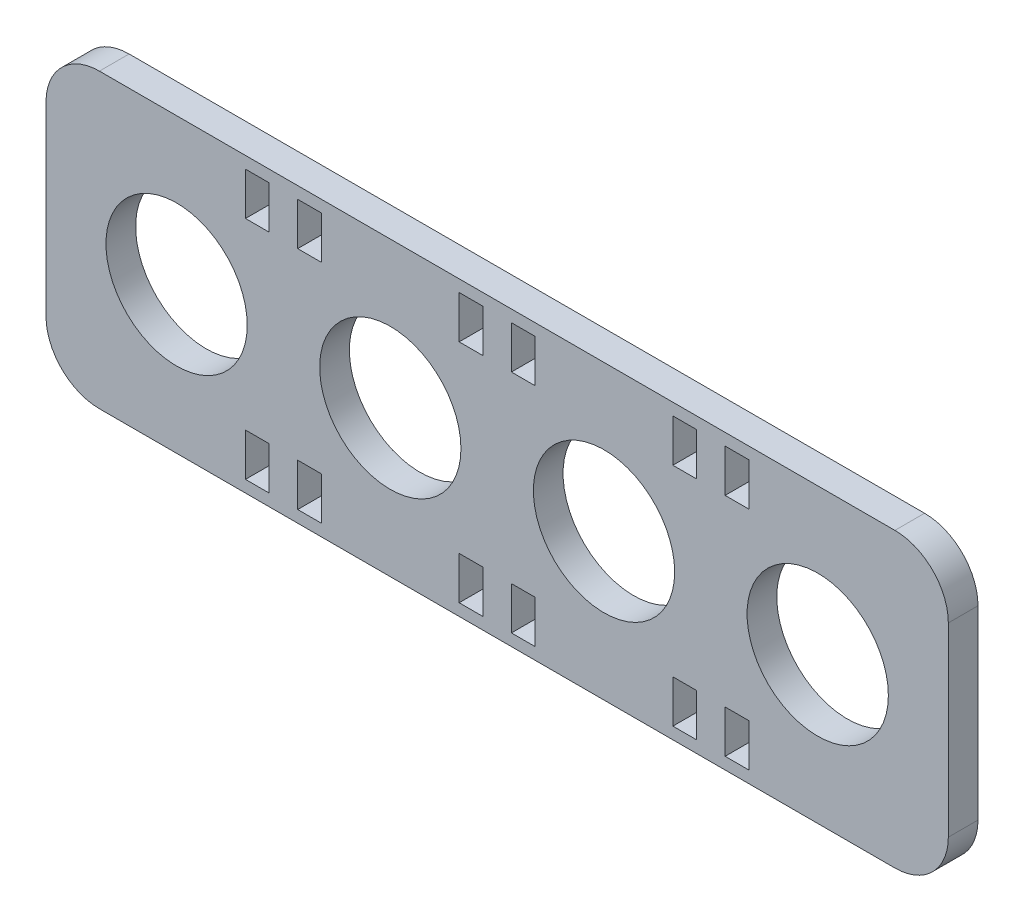
from build123d import *

# Parameters (mm, degrees)
SKETCH1_R           = 7.5565
SKETCH1_W           = 2.54
SKETCH1_H           = 4.572
BOSS_EXTRUDE1_DEPTH = 3.175


with BuildPart() as part:
    # Sketch1 → Boss-Extrude1 (new body)
    with BuildSketch(Plane.XY):
        with BuildLine():
            Line((-8.255, 15.639992312), (76.835, 15.639992312))
            ThreePointArc((76.835, 15.639992312), (80.876115254, 13.966107566), (82.55, 9.924992312))
            Line((82.55, 9.924992312), (82.55, -9.924992312))
            ThreePointArc((82.55, -9.924992312), (80.876115254, -13.966107566), (76.835, -15.639992312))
            Line((76.835, -15.639992312), (-8.255, -15.639992312))
            ThreePointArc((-8.255, -15.639992312), (-12.296115254, -13.966107566), (-13.97, -9.924992312))
            Line((-13.97, -9.924992312), (-13.97, 9.924992312))
            ThreePointArc((-13.97, 9.924992312), (-12.296115254, 13.966107566), (-8.255, 15.639992312))
        make_face()
        Circle(SKETCH1_R, mode=Mode.SUBTRACT)
        with Locations((22.86, 0)):
            Circle(SKETCH1_R, mode=Mode.SUBTRACT)
        with Locations((45.72, 0)):
            Circle(SKETCH1_R, mode=Mode.SUBTRACT)
        with Locations((68.58, 0)):
            Circle(SKETCH1_R, mode=Mode.SUBTRACT)
        with Locations((8.636, 12.083992312)):
            Rectangle(SKETCH1_W, SKETCH1_H, mode=Mode.SUBTRACT)
        with Locations((14.224, 12.083992312)):
            Rectangle(SKETCH1_W, SKETCH1_H, mode=Mode.SUBTRACT)
        with Locations((31.496, 12.083992312)):
            Rectangle(SKETCH1_W, SKETCH1_H, mode=Mode.SUBTRACT)
        with Locations((37.084, 12.083992312)):
            Rectangle(SKETCH1_W, SKETCH1_H, mode=Mode.SUBTRACT)
        with Locations((54.356, 12.083992312)):
            Rectangle(SKETCH1_W, SKETCH1_H, mode=Mode.SUBTRACT)
        with Locations((59.944, 12.083992312)):
            Rectangle(SKETCH1_W, SKETCH1_H, mode=Mode.SUBTRACT)
        with Locations((59.944, -12.083992312)):
            Rectangle(SKETCH1_W, SKETCH1_H, mode=Mode.SUBTRACT)
        with Locations((54.356, -12.083992312)):
            Rectangle(SKETCH1_W, SKETCH1_H, mode=Mode.SUBTRACT)
        with Locations((37.084, -12.083992312)):
            Rectangle(SKETCH1_W, SKETCH1_H, mode=Mode.SUBTRACT)
        with Locations((31.496, -12.083992312)):
            Rectangle(SKETCH1_W, SKETCH1_H, mode=Mode.SUBTRACT)
        with Locations((14.224, -12.083992312)):
            Rectangle(SKETCH1_W, SKETCH1_H, mode=Mode.SUBTRACT)
        with Locations((8.636, -12.083992312)):
            Rectangle(SKETCH1_W, SKETCH1_H, mode=Mode.SUBTRACT)
    extrude(amount=BOSS_EXTRUDE1_DEPTH)


solid = part.part
